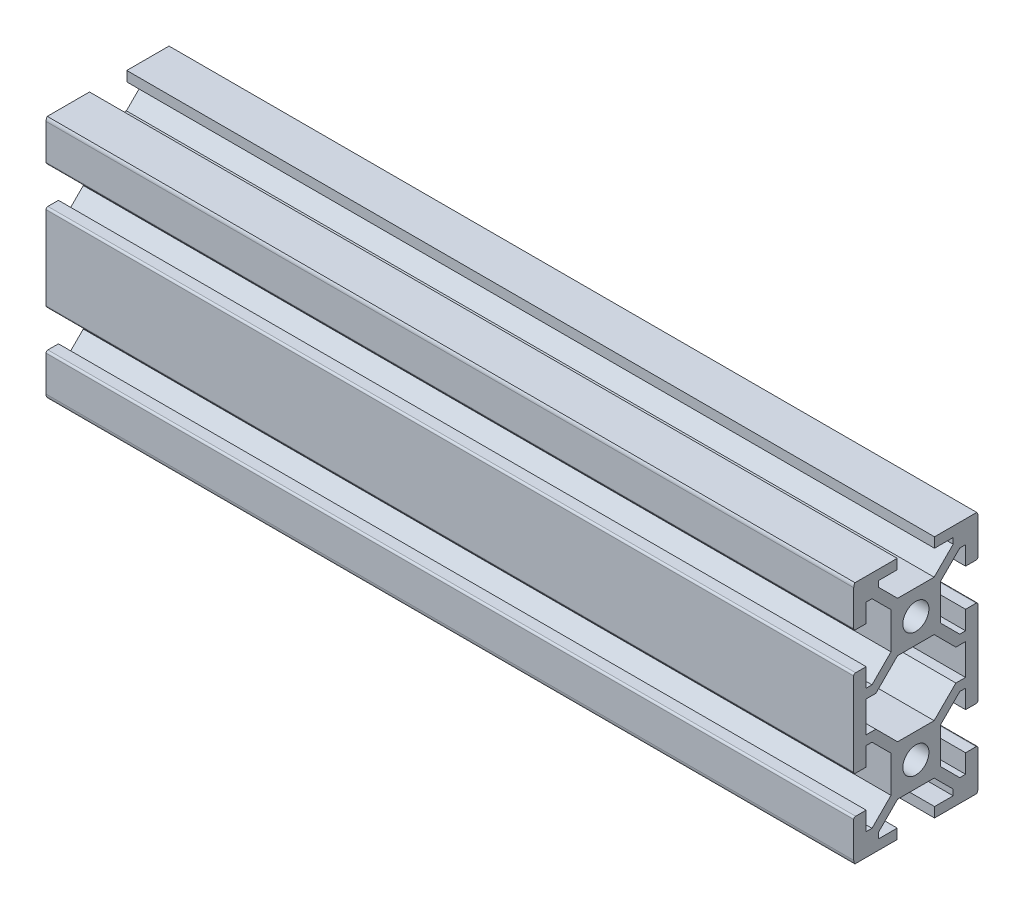
from build123d import *

# Parameters (mm, degrees)
SKETCH_1_R                   = 2.1
SERI_5_20_40_20X40S5_2_DEPTH = 130


with BuildPart() as part:
    # 草图1 → Seri 5 (20,40) 20X40S5(2) (new body)
    with BuildSketch(Plane(origin=(0, 0, 0), x_dir=(0, 0, -1), z_dir=(1, 0, 0))):
        with BuildLine():
            Line((-10, 19), (-10, 13.3))
            ThreePointArc((-10, 13.3), (-9.912132034, 13.087867966), (-9.7, 13))
            Line((-9.7, 13), (-8, 13))
            Line((-8, 13), (-8, 16))
            Line((-8, 16), (-7.060660172, 16))
            Line((-7.060660172, 16), (-4, 12.939339828))
            Line((-4, 12.939339828), (-4, 7.060660172))
            Line((-4, 7.060660172), (-7.060660172, 4))
            Line((-7.060660172, 4), (-8, 4))
            Line((-8, 4), (-8, 7))
            Line((-8, 7), (-9.7, 7))
            ThreePointArc((-9.7, 7), (-9.912132034, 6.912132034), (-10, 6.7))
            Line((-10, 6.7), (-10, -6.7))
            ThreePointArc((-10, -6.7), (-9.912132034, -6.912132034), (-9.7, -7))
            Line((-9.7, -7), (-8, -7))
            Line((-8, -7), (-8, -4))
            Line((-8, -4), (-7.060660172, -4))
            Line((-7.060660172, -4), (-4, -7.060660172))
            Line((-4, -7.060660172), (-4, -12.939339828))
            Line((-4, -12.939339828), (-7.060660172, -16))
            Line((-7.060660172, -16), (-8, -16))
            Line((-8, -16), (-8, -13))
            Line((-8, -13), (-9.7, -13))
            ThreePointArc((-9.7, -13), (-9.912132034, -13.087867966), (-10, -13.3))
            Line((-10, -13.3), (-10, -19))
            ThreePointArc((-10, -19), (-9.948683298, -19.316227766), (-9.8, -19.6))
            Line((-9.8, -19.6), (-3, -19.6))
            Line((-3, -19.6), (-3, -18))
            Line((-3, -18), (-6, -18))
            Line((-6, -18), (-6, -17.060660172))
            Line((-6, -17.060660172), (-2.939339828, -14))
            Line((-2.939339828, -14), (2.939339828, -14))
            Line((2.939339828, -14), (6, -17.060660172))
            Line((6, -17.060660172), (6, -18))
            Line((6, -18), (3, -18))
            Line((3, -18), (3, -19.6))
            Line((3, -19.6), (9.8, -19.6))
            ThreePointArc((9.8, -19.6), (9.948683298, -19.316227766), (10, -19))
            Line((10, -19), (10, -13.3))
            ThreePointArc((10, -13.3), (9.912132034, -13.087867966), (9.7, -13))
            Line((9.7, -13), (8, -13))
            Line((8, -13), (8, -16))
            Line((8, -16), (7.060660172, -16))
            Line((7.060660172, -16), (4, -12.939339828))
            Line((4, -12.939339828), (4, -7.060660172))
            Line((4, -7.060660172), (7.060660172, -4))
            Line((7.060660172, -4), (8, -4))
            Line((8, -4), (8, -7))
            Line((8, -7), (9.7, -7))
            ThreePointArc((9.7, -7), (9.912132034, -6.912132034), (10, -6.7))
            Line((10, -6.7), (10, 6.7))
            ThreePointArc((10, 6.7), (9.912132034, 6.912132034), (9.7, 7))
            Line((9.7, 7), (8, 7))
            Line((8, 7), (8, 4))
            Line((8, 4), (7.060660172, 4))
            Line((7.060660172, 4), (4, 7.060660172))
            Line((4, 7.060660172), (4, 12.939339828))
            Line((4, 12.939339828), (7.060660172, 16))
            Line((7.060660172, 16), (8, 16))
            Line((8, 16), (8, 13))
            Line((8, 13), (9.7, 13))
            ThreePointArc((9.7, 13), (9.912132034, 13.087867966), (10, 13.3))
            Line((10, 13.3), (10, 19))
            ThreePointArc((10, 19), (9.948683298, 19.316227766), (9.8, 19.6))
            Line((9.8, 19.6), (3, 19.6))
            Line((3, 19.6), (3, 18))
            Line((3, 18), (6, 18))
            Line((6, 18), (6, 17.060660172))
            Line((6, 17.060660172), (2.939339828, 14))
            Line((2.939339828, 14), (-2.939339828, 14))
            Line((-2.939339828, 14), (-6, 17.060660172))
            Line((-6, 17.060660172), (-6, 18))
            Line((-6, 18), (-3, 18))
            Line((-3, 18), (-3, 19.6))
            Line((-3, 19.6), (-9.8, 19.6))
            ThreePointArc((-9.8, 19.6), (-9.948683298, 19.316227766), (-10, 19))
        make_face()
        with Locations((0, -10)):
            Circle(SKETCH_1_R, mode=Mode.SUBTRACT)
        with Locations((0, 10)):
            Circle(SKETCH_1_R, mode=Mode.SUBTRACT)
        Polygon((-8, -2.5), (-6.439339828, -2.5), (-2.939339828, -6), (2.939339828, -6), (6.439339828, -2.5), (8, -2.5), (8, 2.5), (6.439339828, 2.5), (2.939339828, 6), (-2.939339828, 6), (-6.439339828, 2.5), (-8, 2.5), align=None, mode=Mode.SUBTRACT)
    extrude(amount=SERI_5_20_40_20X40S5_2_DEPTH)


solid = part.part
